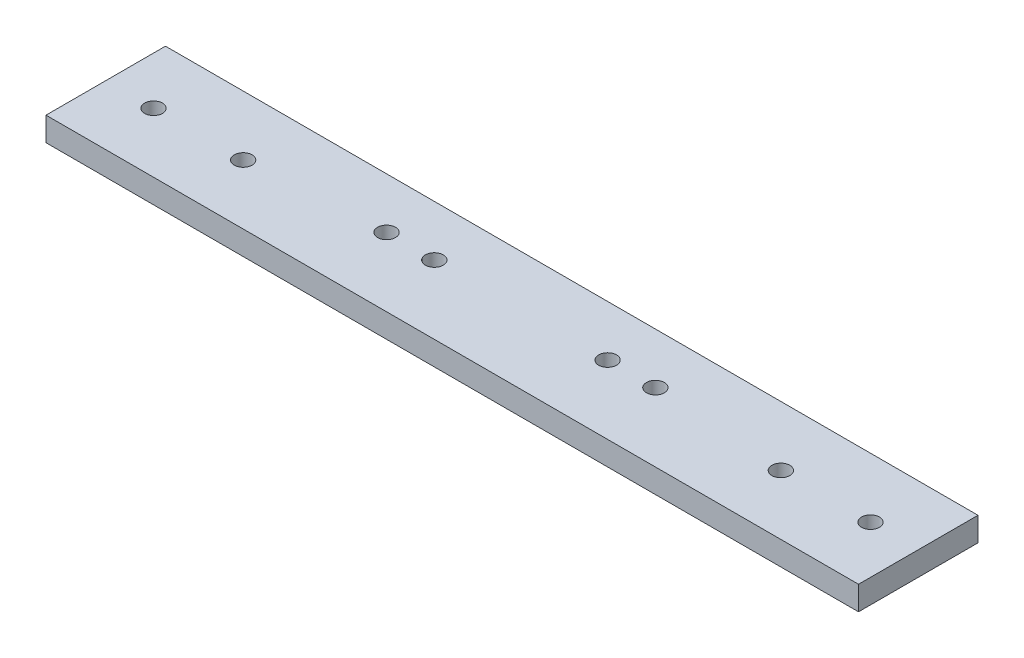
from build123d import *

# Parameters (mm, degrees)
SKETCH1_W           = 136
SKETCH1_H           = 20
SKETCH1_R           = 1.5
BOSS_EXTRUDE1_DEPTH = 4


with BuildPart() as part:
    # Sketch1 → Boss-Extrude1 (new body)
    with BuildSketch(Plane(origin=(0, 0, 0), x_dir=(1, 0, 0), z_dir=(0, 1, 0))):
        Rectangle(SKETCH1_W, SKETCH1_H)
        with Locations(Location((22.5, 1.5, 0), (0, 0, 270))):
            Circle(SKETCH1_R, mode=Mode.SUBTRACT)
        with Locations(Location((14.5, 1.5, 0), (0, 0, 270))):
            Circle(SKETCH1_R, mode=Mode.SUBTRACT)
        with Locations(Location((-14.5, 1.5, 0), (0, 0, 90))):
            Circle(SKETCH1_R, mode=Mode.SUBTRACT)
        with Locations(Location((-22.5, 1.5, 0), (0, 0, 90))):
            Circle(SKETCH1_R, mode=Mode.SUBTRACT)
        with Locations(Location((60, 0, 0), (0, 0, 270))):
            Circle(SKETCH1_R, mode=Mode.SUBTRACT)
        with Locations(Location((45, 0, 0), (0, 0, 270))):
            Circle(SKETCH1_R, mode=Mode.SUBTRACT)
        with Locations(Location((-45, 0, 0), (0, 0, 90))):
            Circle(SKETCH1_R, mode=Mode.SUBTRACT)
        with Locations(Location((-60, 0, 0), (0, 0, 90))):
            Circle(SKETCH1_R, mode=Mode.SUBTRACT)
    extrude(amount=BOSS_EXTRUDE1_DEPTH)


solid = part.part
